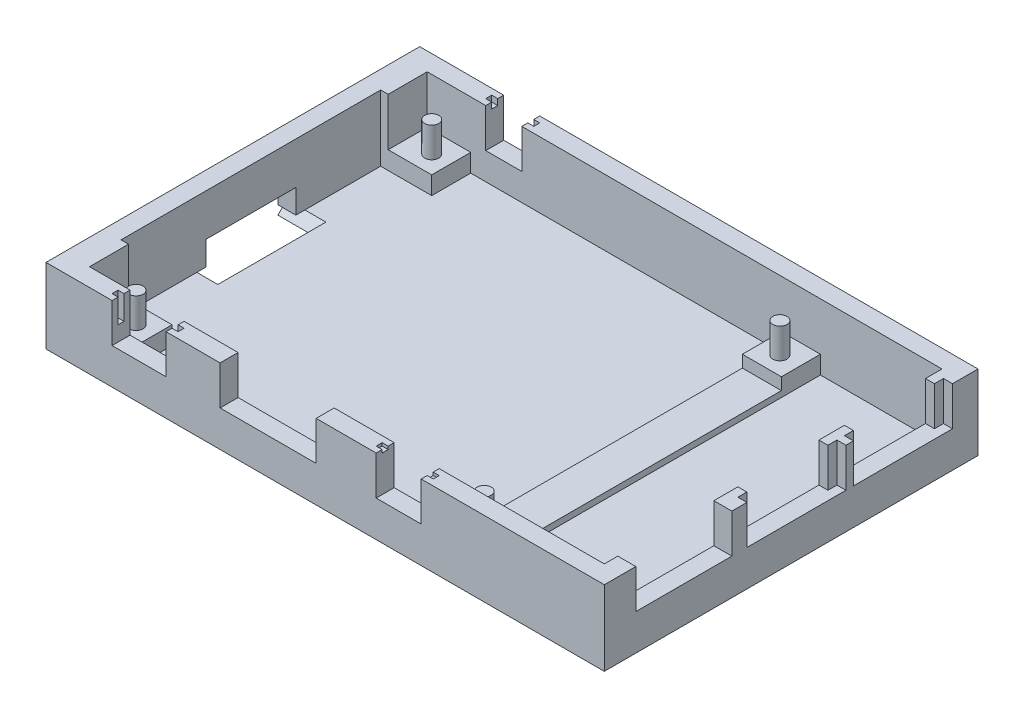
from build123d import *

# Parameters (mm, degrees)
SKETCH1_W           = 85
SKETCH1_H           = 56.25
BOSS_EXTRUDE1_DEPTH = 1.5
SKETCH2_W           = 6.5
SKETCH2_H           = 6.5
BOSS_EXTRUDE2_DEPTH = 3
SKETCH3_R           = 1.175
BOSS_EXTRUDE3_DEPTH = 5
SKETCH4_W           = 56.25
SKETCH4_H           = 1.5
BOSS_EXTRUDE4_DEPTH = 5
BOSS_EXTRUDE5_DEPTH = 11
SKETCH6_W           = 90
SKETCH6_H           = 3
BOSS_EXTRUDE6_DEPTH = 12.5
SKETCH7_W           = 6
SKETCH7_H           = 3
SKETCH7_W_2         = 9
SKETCH7_W_3         = 16
SKETCH7_W_4         = 7.5
SKETCH7_W_5         = 3
SKETCH7_H_2         = 16
CUT_EXTRUDE1_DEPTH  = 6.5
CUT_EXTRUDE2_DEPTH  = 6.5
SKETCH9_W           = 6.5
SKETCH9_H           = 43.25
BOSS_EXTRUDE7_DEPTH = 1
SKETCH10_W          = 9.5
SKETCH10_H          = 1
CUT_EXTRUDE3_DEPTH  = 0.5
SKETCH11_W          = 11
SKETCH11_H          = 1
CUT_EXTRUDE4_DEPTH  = 4
SKETCH12_W          = 8
SKETCH12_H          = 1
CUT_EXTRUDE5_DEPTH  = 1
SKETCH13_W          = 0.75
SKETCH13_H          = 56.25
CUT_EXTRUDE6_DEPTH  = 8


with BuildPart() as part:
    # Sketch1 → Boss-Extrude1 (new body)
    with BuildSketch(Plane(origin=(0, 0, 0), x_dir=(1, 0, 0), z_dir=(0, 1, 0))):
        with Locations((42.5, 28.125)):
            Rectangle(SKETCH1_W, SKETCH1_H)
    extrude(amount=BOSS_EXTRUDE1_DEPTH)

    # Sketch2 → Boss-Extrude2 (add)
    with BuildSketch(Plane(origin=(0, 1.5, 0), x_dir=(1, 0, 0), z_dir=(0, 1, 0))):
        with Locations((3.25, 3.25)):
            Rectangle(SKETCH2_W, SKETCH2_H)
        with Locations((61.5, 3.25)):
            Rectangle(SKETCH2_W, SKETCH2_H)
        with Locations((61.5, 53)):
            Rectangle(SKETCH2_W, SKETCH2_H)
        with Locations((3.25, 53)):
            Rectangle(SKETCH2_W, SKETCH2_H)
    extrude(amount=BOSS_EXTRUDE2_DEPTH)

    # Sketch3 → Boss-Extrude3 (add)
    with BuildSketch(Plane(origin=(0, 4.5, 0), x_dir=(1, 0, 0), z_dir=(0, 1, 0))):
        with Locations(Location((3.5, 3.5, 0), (0, 0, 90))):
            Circle(SKETCH3_R)
        with Locations(Location((61.5, 3.5, 0), (0, 0, 90))):
            Circle(SKETCH3_R)
        with Locations(Location((61.5, 52.75, 0), (0, 0, 90))):
            Circle(SKETCH3_R)
        with Locations(Location((3.5, 52.75, 0), (0, 0, 90))):
            Circle(SKETCH3_R)
    extrude(amount=BOSS_EXTRUDE3_DEPTH)

    # Sketch4 → Boss-Extrude4 (add)
    with BuildSketch(Plane.ZY):
        with Locations((-28.125, 0.75)):
            Rectangle(SKETCH4_W, SKETCH4_H)
    extrude(amount=BOSS_EXTRUDE4_DEPTH)

    # Sketch5 → Boss-Extrude5 (add)
    with BuildSketch(Plane(origin=(0, 1.5, 0), x_dir=(1, 0, 0), z_dir=(0, 1, 0))):
        Polygon((-5, 0), (-2.5, 0), (0, 0), (0, 6.5), (-2, 6.5), (-2, 49.75), (0, 49.75), (0, 56.25), (-2.5, 56.25), (-5, 56.25), align=None)
    extrude(amount=BOSS_EXTRUDE5_DEPTH)

    # Sketch6 → Boss-Extrude6 (add)
    with BuildSketch(Plane(origin=(0, 0, 0), x_dir=(1, 0, 0), z_dir=(0, 1, 0))):
        with Locations((40, -1.5)):
            Rectangle(SKETCH6_W, SKETCH6_H)
        Polygon((85, 56.25), (85, 0), (85, -3), (88, -3), (88, 56.25), align=None)
        Polygon((-5, 56.25), (85, 56.25), (88, 56.25), (88, 59.25), (-5, 59.25), align=None)
    extrude(amount=BOSS_EXTRUDE6_DEPTH)

    # Sketch7 → Cut-Extrude1 (cut)
    with BuildSketch(Plane(origin=(0, 12.5, 0), x_dir=(1, 0, 0), z_dir=(0, 1, 0))):
        with Locations((12, 57.75)):
            Rectangle(SKETCH7_W, SKETCH7_H)
        Polygon((86.5, 40), (86.5, 38.5), (88, 38.5), (88, 55), (86.5, 55), (86.5, 53.5), (85, 53.5), (85, 40), align=None)
        with Locations((10.5, -1.5)):
            Rectangle(SKETCH7_W_2, SKETCH7_H)
        with Locations((32, -1.5)):
            Rectangle(SKETCH7_W_3, SKETCH7_H)
        with Locations((53.75, -1.5)):
            Rectangle(SKETCH7_W_4, SKETCH7_H)
        with Locations((86.5, 10.25)):
            Rectangle(SKETCH7_W_5, SKETCH7_H_2)
        Polygon((86.5, 35.75), (86.5, 37.25), (88, 37.25), (88, 20.75), (86.5, 20.75), (86.5, 22.25), (85, 22.25), (85, 35.75), align=None)
    extrude(amount=-CUT_EXTRUDE1_DEPTH, mode=Mode.SUBTRACT)

    # Sketch8 → Cut-Extrude2 (cut)
    with BuildSketch(Plane.ZY.offset(5)):
        Polygon((-35.625, 0), (-20.625, 0), (-19.125, 1.5), (-20.625, 1.5), (-20.625, 5.5), (-35.625, 5.5), (-35.625, 1.5), (-37.125, 1.5), align=None)
    extrude(amount=-CUT_EXTRUDE2_DEPTH, mode=Mode.SUBTRACT)

    # Sketch9 → Boss-Extrude7 (add)
    with BuildSketch(Plane(origin=(0, 1.5, 0), x_dir=(1, 0, 0), z_dir=(0, 1, 0))):
        with Locations((61.5, 28.125)):
            Rectangle(SKETCH9_W, SKETCH9_H)
    extrude(amount=BOSS_EXTRUDE7_DEPTH)

    # Sketch10 → Cut-Extrude3 (cut)
    with BuildSketch(Plane(origin=(0, 12.5, 0), x_dir=(1, 0, 0), z_dir=(0, 1, 0))):
        with Locations((53.75, -1.5)):
            Rectangle(SKETCH10_W, SKETCH10_H)
    extrude(amount=-CUT_EXTRUDE3_DEPTH, mode=Mode.SUBTRACT)

    # Sketch11 → Cut-Extrude4 (cut)
    with BuildSketch(Plane(origin=(0, 12.5, 0), x_dir=(1, 0, 0), z_dir=(0, 1, 0))):
        with Locations((10.5, -1.5)):
            Rectangle(SKETCH11_W, SKETCH11_H)
    extrude(amount=-CUT_EXTRUDE4_DEPTH, mode=Mode.SUBTRACT)

    # Sketch12 → Cut-Extrude5 (cut)
    with BuildSketch(Plane(origin=(0, 12.5, 0), x_dir=(1, 0, 0), z_dir=(0, 1, 0))):
        with Locations((12, 57.75)):
            Rectangle(SKETCH12_W, SKETCH12_H)
    extrude(amount=-CUT_EXTRUDE5_DEPTH, mode=Mode.SUBTRACT)

    # Sketch13 → Cut-Extrude6 (cut)
    with BuildSketch(Plane(origin=(0, 12.5, 0), x_dir=(1, 0, 0), z_dir=(0, 1, 0))):
        with Locations((-0.375, 28.125)):
            Rectangle(SKETCH13_W, SKETCH13_H)
    extrude(amount=-CUT_EXTRUDE6_DEPTH, mode=Mode.SUBTRACT)


solid = part.part
